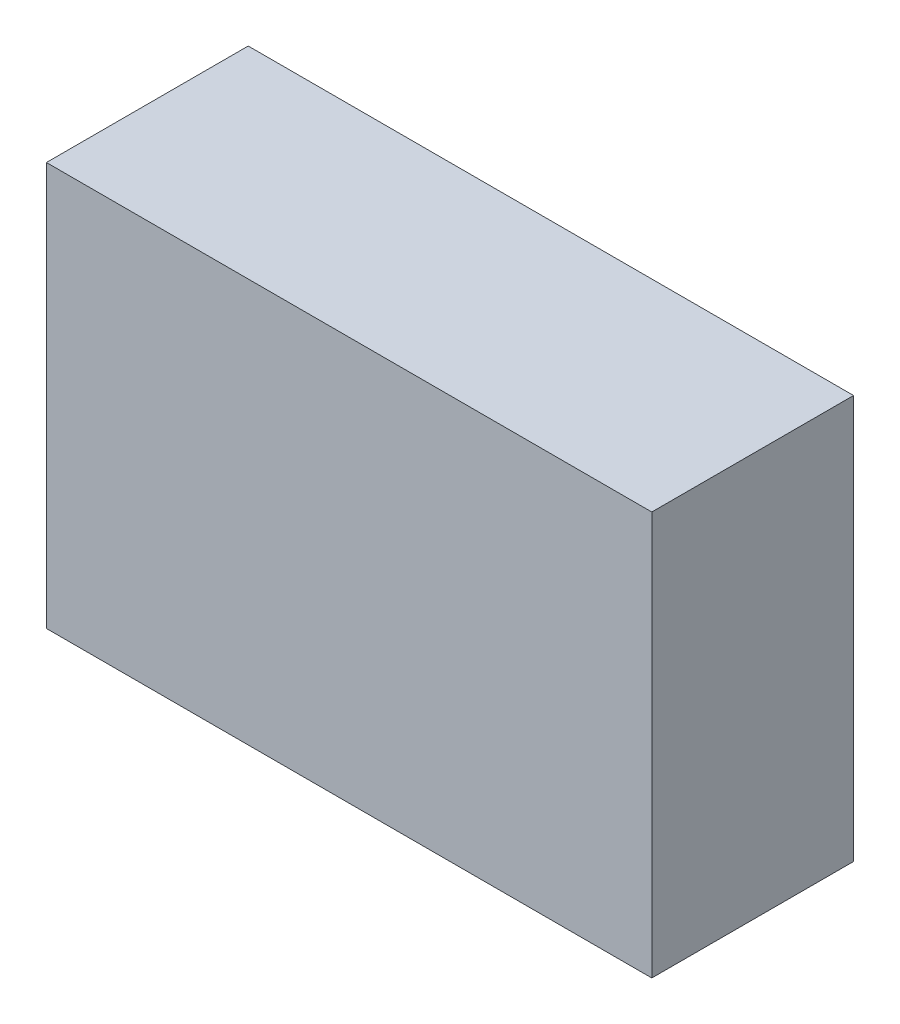
from build123d import *

# Parameters (mm, degrees)
SKETCH1_W           = 60
SKETCH1_H           = 40
BOSS_EXTRUDE1_DEPTH = 20
SKETCH2_W           = 2.54960173
SKETCH2_H           = 4.461803028
CUT_EXTRUDE1_DEPTH  = 20


with BuildPart() as part:
    # Sketch1 → Boss-Extrude1 (new body)
    with BuildSketch(Plane.XY):
        with Locations((-20.448430493, 17.533632287)):
            Rectangle(SKETCH1_W, SKETCH1_H)
    extrude(amount=BOSS_EXTRUDE1_DEPTH)

    # Sketch2 → Cut-Extrude1 (cut)
    with BuildSketch(Plane.ZY.offset(50.448430493)):
        with Locations((1.341977458, 17.533632287)):
            Rectangle(SKETCH2_W, SKETCH2_H)
    extrude(amount=-CUT_EXTRUDE1_DEPTH, mode=Mode.SUBTRACT)


solid = part.part
